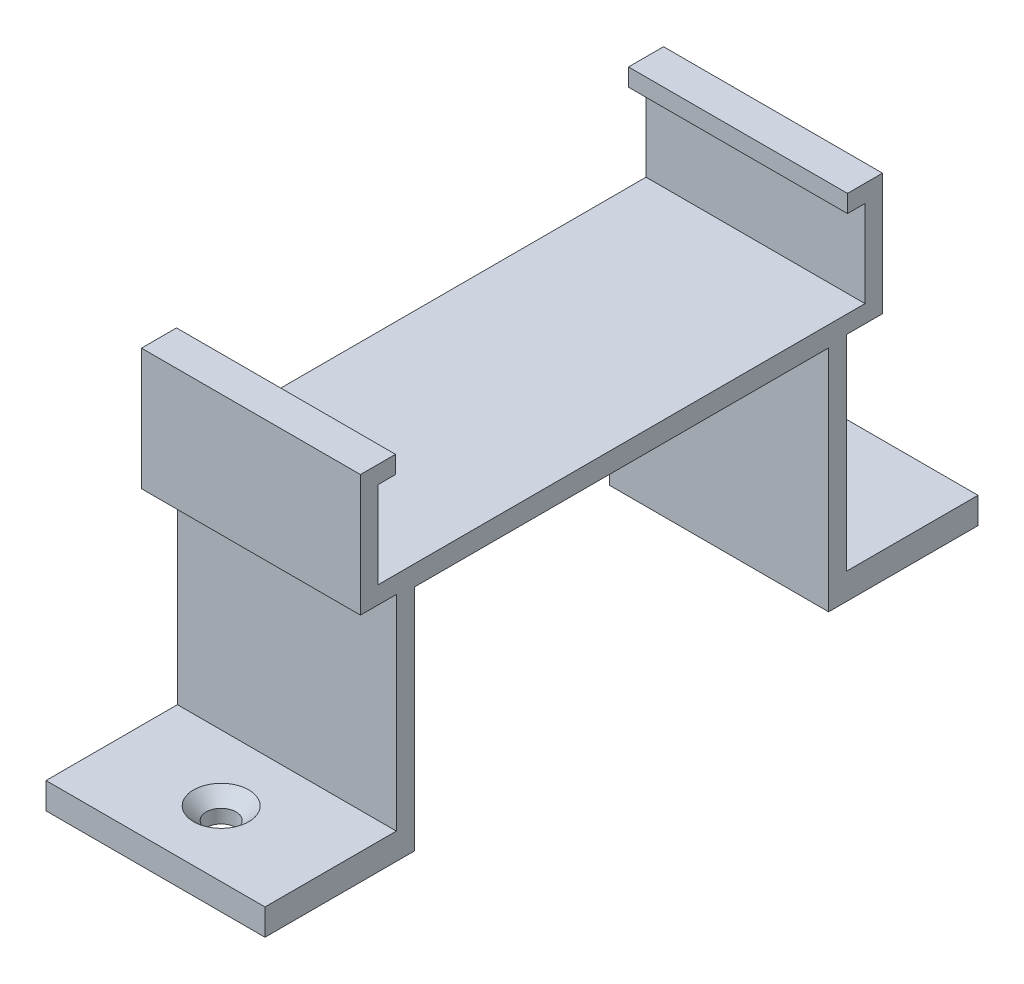
from build123d import *

# Parameters (mm, degrees)
SKETCH1_W                                       = 25
SKETCH1_H                                       = 51.4
BOSS_EXTRUDE1_DEPTH                             = 28.4
SKETCH2_W                                       = 47.3
SKETCH2_H                                       = 27.1
CUT_EXTRUDE1_DEPTH                              = 147
BOSS_EXTRUDE2_DEPTH                             = 11.9
BOSS_EXTRUDE2_DEPTH_BACK                        = 2
SKETCH4_W                                       = 25
SKETCH4_H                                       = 59.6
SKETCH5_W                                       = 55.6
SKETCH5_H                                       = 9.9
CUT_EXTRUDE5_DEPTH                              = 57.010088377
SKETCH6_W                                       = 51.6
SKETCH6_H                                       = 2
CUT_EXTRUDE6_DEPTH                              = 57.010088377
SKETCH7_W                                       = 25
SKETCH7_H                                       = 3
BOSS_EXTRUDE3_DEPTH                             = 15
SKETCH8_W                                       = 25
SKETCH8_H                                       = 3
BOSS_EXTRUDE4_DEPTH                             = 15
CSK_FOR_M3_FLAT_HEAD_MACHINE_SCREW4_D           = 3.4
CSK_FOR_M3_FLAT_HEAD_MACHINE_SCREW4_DEPTH       = 10.4
CSK_FOR_M3_FLAT_HEAD_MACHINE_SCREW4_CSINK_D     = 6.3
CSK_FOR_M3_FLAT_HEAD_MACHINE_SCREW4_CSINK_ANGLE = 90
CSK_FOR_M3_FLAT_HEAD_MACHINE_SCREW4_TIP         = 1.021463052


with BuildPart() as part:
    # Sketch1 → Boss-Extrude1 (new body)
    with BuildSketch(Plane(origin=(0, 0, 0), x_dir=(1, 0, 0), z_dir=(0, 1, 0))):
        Rectangle(SKETCH1_W, SKETCH1_H)
    extrude(amount=BOSS_EXTRUDE1_DEPTH)

    # Sketch2 → Cut-Extrude1 (cut)
    with BuildSketch(Plane(origin=(12.5, 0, 0), x_dir=(0, 0, -1), z_dir=(1, 0, 0))):
        with Locations((0, 12.55)):
            Rectangle(SKETCH2_W, SKETCH2_H)
    extrude(amount=-CUT_EXTRUDE1_DEPTH, mode=Mode.SUBTRACT)

    # Sketch4 → Boss-Extrude2 (add, two sides: drawn at the far end of the back side and taken through both)
    with BuildSketch(Plane(origin=(0, 28.4, 0), x_dir=(1, 0, 0), z_dir=(0, 1, 0)).offset(-BOSS_EXTRUDE2_DEPTH_BACK)):
        Rectangle(SKETCH4_W, SKETCH4_H)
    extrude(amount=BOSS_EXTRUDE2_DEPTH + BOSS_EXTRUDE2_DEPTH_BACK)

    # Sketch5 → Cut-Extrude5 (cut, through all)
    with BuildSketch(Plane.ZY.offset(12.5)):
        with Locations((0, 33.35)):
            Rectangle(SKETCH5_W, SKETCH5_H)
    extrude(amount=-CUT_EXTRUDE5_DEPTH, mode=Mode.SUBTRACT)

    # Sketch6 → Cut-Extrude6 (cut, through all)
    with BuildSketch(Plane.ZY.offset(12.5)):
        with Locations((0, 39.3)):
            Rectangle(SKETCH6_W, SKETCH6_H)
    extrude(amount=-CUT_EXTRUDE6_DEPTH, mode=Mode.SUBTRACT)

    # Sketch7 → Boss-Extrude3 (add)
    with BuildSketch(Plane(origin=(0, 0, -25.7), x_dir=(-1, 0, 0), z_dir=(0, 0, -1))):
        with Locations((0, 1.5)):
            Rectangle(SKETCH7_W, SKETCH7_H)
    extrude(amount=BOSS_EXTRUDE3_DEPTH)

    # Sketch8 → Boss-Extrude4 (add)
    with BuildSketch(Plane.XY.offset(25.7)):
        with Locations((0, 1.5)):
            Rectangle(SKETCH8_W, SKETCH8_H)
    extrude(amount=BOSS_EXTRUDE4_DEPTH)

    # CSK for M3 Flat Head Machine Screw4
    with Locations(Plane(origin=(0, 3, 0), x_dir=(1, 0, 0), z_dir=(0, 1, 0))):
        with Locations((0, 33.2), (0, -33.2)):
            CounterSinkHole(CSK_FOR_M3_FLAT_HEAD_MACHINE_SCREW4_D / 2, CSK_FOR_M3_FLAT_HEAD_MACHINE_SCREW4_CSINK_D / 2, depth=CSK_FOR_M3_FLAT_HEAD_MACHINE_SCREW4_DEPTH, counter_sink_angle=CSK_FOR_M3_FLAT_HEAD_MACHINE_SCREW4_CSINK_ANGLE)
            with Locations((0, 0, -(CSK_FOR_M3_FLAT_HEAD_MACHINE_SCREW4_DEPTH + CSK_FOR_M3_FLAT_HEAD_MACHINE_SCREW4_TIP / 2))):  # 118° drill point
                Cone(0, CSK_FOR_M3_FLAT_HEAD_MACHINE_SCREW4_D / 2, CSK_FOR_M3_FLAT_HEAD_MACHINE_SCREW4_TIP, mode=Mode.SUBTRACT)


solid = part.part
